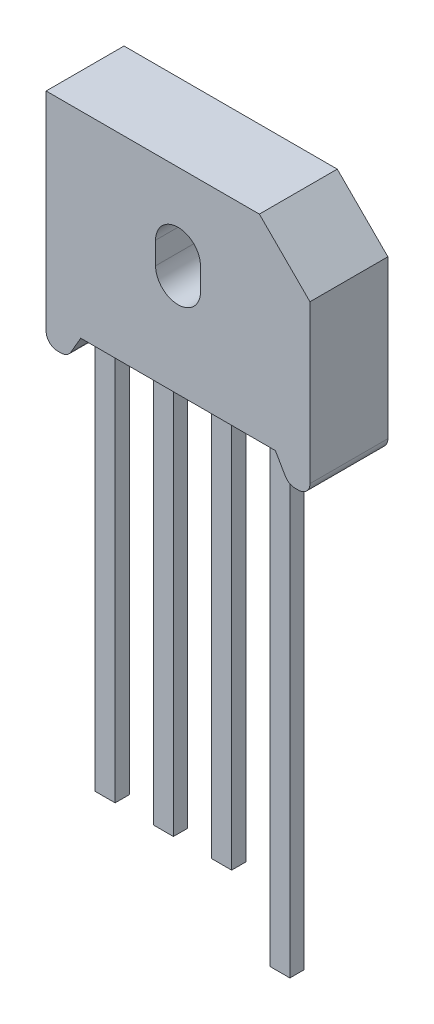
from build123d import *

# Parameters (mm, degrees)
BOSS_EXTRUDE1_DEPTH = 3.425
SKETCH2_W           = 1.75
SKETCH2_H           = 1.25
BOSS_EXTRUDE2_DEPTH = 35.15
SKETCH3_W           = 1.75
SKETCH3_H           = 1.25
BOSS_EXTRUDE3_DEPTH = 5.65


with BuildPart() as part:
    # Sketch1 → Boss-Extrude1 (new, symmetric)
    with BuildSketch(Plane.XY):
        with BuildLine():
            Line((7.15, 14.403910503), (-11.6, 14.403910503))
            Line((-11.6, 14.403910503), (-11.6, -2.896089497))
            Line((-11.6, -2.896089497), (-11.6, -3.896089497))
            ThreePointArc((-11.6, -3.896089497), (-11.307106781, -4.603196278), (-10.6, -4.896089497))
            Line((-10.6, -4.896089497), (-10.28914747, -4.896089497))
            ThreePointArc((-10.28914747, -4.896089497), (-9.78914747, -4.762114901), (-9.423122066, -4.396089497))
            Line((-9.423122066, -4.396089497), (-8.558813185, -2.899062602))
            Line((-8.558813185, -2.899062602), (8.558813185, -2.899062602))
            Line((8.558813185, -2.899062602), (9.423122066, -4.396089497))
            ThreePointArc((9.423122066, -4.396089497), (9.78914747, -4.762114901), (10.28914747, -4.896089497))
            Line((10.28914747, -4.896089497), (10.6, -4.896089497))
            ThreePointArc((10.6, -4.896089497), (11.307106781, -4.603196278), (11.6, -3.896089497))
            Line((11.6, -3.896089497), (11.6, -2.896089497))
            Line((11.6, -2.896089497), (11.6, 9.953910503))
            Line((11.6, 9.953910503), (7.15, 14.403910503))
        make_face()
        with BuildLine():
            ThreePointArc((-1.975, 7.853910503), (0, 9.828910503), (1.975, 7.853910503))
            Line((1.975, 7.853910503), (1.975, 5.903910503))
            ThreePointArc((1.975, 5.903910503), (0, 3.928910503), (-1.975, 5.903910503))
            Line((-1.975, 5.903910503), (-1.975, 7.853910503))
        make_face(mode=Mode.SUBTRACT)
    extrude(amount=BOSS_EXTRUDE1_DEPTH, both=True)

    # Sketch2 → Boss-Extrude2 (add)
    with BuildSketch(Plane.XZ.offset(2.899062602)):
        with Locations((-7.683813185, 1.525)):
            Rectangle(SKETCH2_W, SKETCH2_H)
        with Locations((-2.561271062, 1.525)):
            Rectangle(SKETCH2_W, SKETCH2_H)
        with Locations((2.561271062, 1.525)):
            Rectangle(SKETCH2_W, SKETCH2_H)
        with Locations((7.683813185, 1.525)):
            Rectangle(SKETCH2_W, SKETCH2_H)
    extrude(amount=BOSS_EXTRUDE2_DEPTH)

    # Sketch3 → Boss-Extrude3 (add)
    with BuildSketch(Plane.XZ.offset(38.049062602)):
        with Locations((7.683813185, 1.525)):
            Rectangle(SKETCH3_W, SKETCH3_H)
    extrude(amount=BOSS_EXTRUDE3_DEPTH)


solid = part.part
